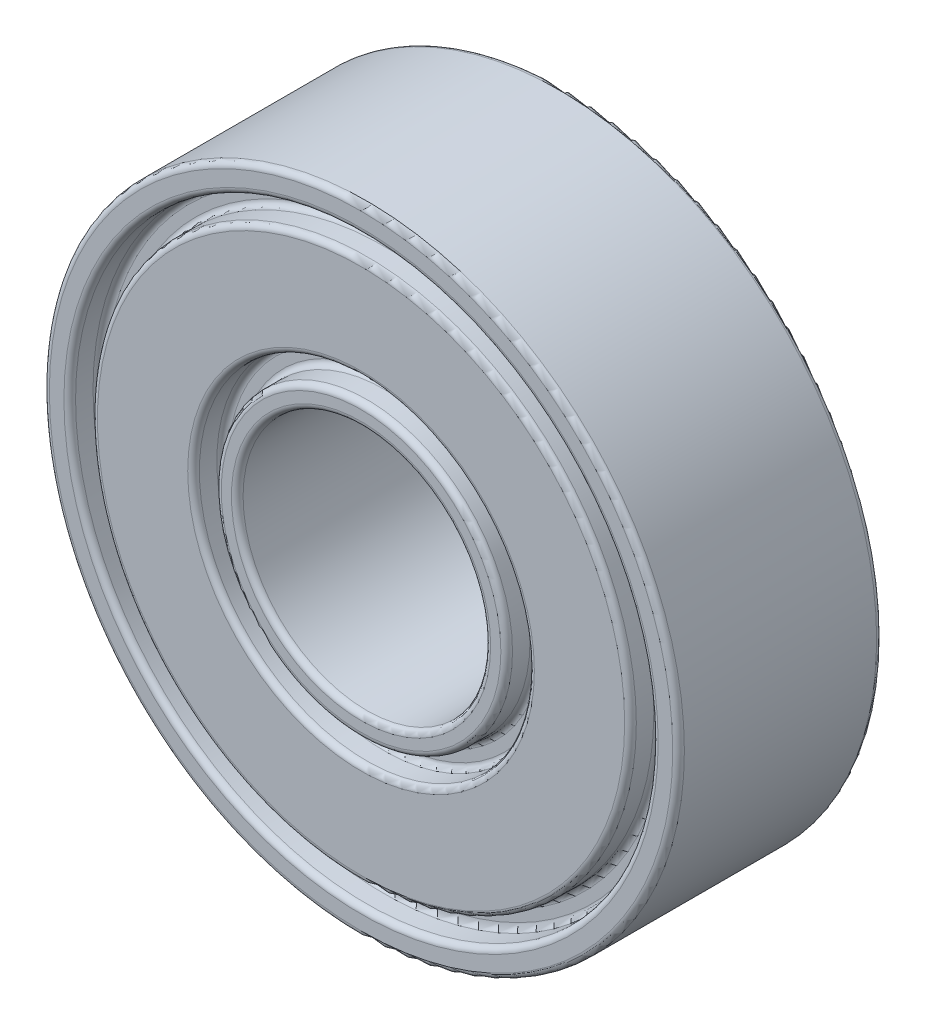
from build123d import *

# Parameters (mm, degrees)
SKETCH1_R           = 10.9
BOSS_EXTRUDE1_DEPTH = 7
SKETCH2_R           = 4.25
CUT_EXTRUDE1_DEPTH  = 7
SKETCH3_R           = 10
SKETCH3_R_2         = 9.25
SKETCH3_R_3         = 5.75
SKETCH3_R_4         = 5
CUT_EXTRUDE2_DEPTH  = 1
CUT_EXTRUDE3_START  = 6
SKETCH4_R           = 10
SKETCH4_R_2         = 9.25
SKETCH4_R_3         = 5.75
SKETCH4_R_4         = 5
CUT_EXTRUDE3_DEPTH  = 1
FILLET1_R           = 0.2


with BuildPart() as part:
    # Sketch1 → Boss-Extrude1 (new body)
    with BuildSketch(Plane.XY):
        Circle(SKETCH1_R)
    extrude(amount=BOSS_EXTRUDE1_DEPTH)

    # Sketch2 → Cut-Extrude1 (cut)
    with BuildSketch(Plane.XY):
        Circle(SKETCH2_R)
    extrude(amount=CUT_EXTRUDE1_DEPTH, mode=Mode.SUBTRACT)

    # Sketch3 → Cut-Extrude2 (cut)
    # profile 1 of 2: a face of its own
    with BuildSketch(Plane.XY):
        Circle(SKETCH3_R)
        Circle(SKETCH3_R_2, mode=Mode.SUBTRACT)
    # profile 2 of 2: a face of its own
    with BuildSketch(Plane.XY):
        Circle(SKETCH3_R_3)
        Circle(SKETCH3_R_4, mode=Mode.SUBTRACT)
    extrude(amount=CUT_EXTRUDE2_DEPTH, mode=Mode.SUBTRACT)

    # Sketch4 → Cut-Extrude3 (cut)
    # profile 1 of 2: a face of its own
    with BuildSketch(Plane.XY.offset(CUT_EXTRUDE3_START)):
        Circle(SKETCH4_R)
        Circle(SKETCH4_R_2, mode=Mode.SUBTRACT)
    # profile 2 of 2: a face of its own
    with BuildSketch(Plane.XY.offset(CUT_EXTRUDE3_START)):
        Circle(SKETCH4_R_3)
        Circle(SKETCH4_R_4, mode=Mode.SUBTRACT)
    extrude(amount=CUT_EXTRUDE3_DEPTH, mode=Mode.SUBTRACT)

    # Fillet1
    fillet1_edges = [part.edges().sort_by_distance(p)[0] for p in [
        (-9.25, 0, 1),
        (-10, 0, 0),
        (-10, 0, 1),
        (-9.25, 0, 0),
        (-5, 0, 1),
        (-5.75, 0, 0),
        (-5.75, 0, 1),
        (-5, 0, 0),
        (-10.9, 0, 0),
        (-5.75, 0, 6),
        (-5, 0, 6),
        (-5.75, 0, 7),
        (-5, 0, 7),
        (-10, 0, 6),
        (-9.25, 0, 6),
        (-10, 0, 7),
        (-9.25, 0, 7),
        (-10.9, 0, 7),
        (-4.25, 0, 0),
        (-4.25, 0, 7),
    ]]
    fillet(fillet1_edges, radius=FILLET1_R)


solid = part.part
